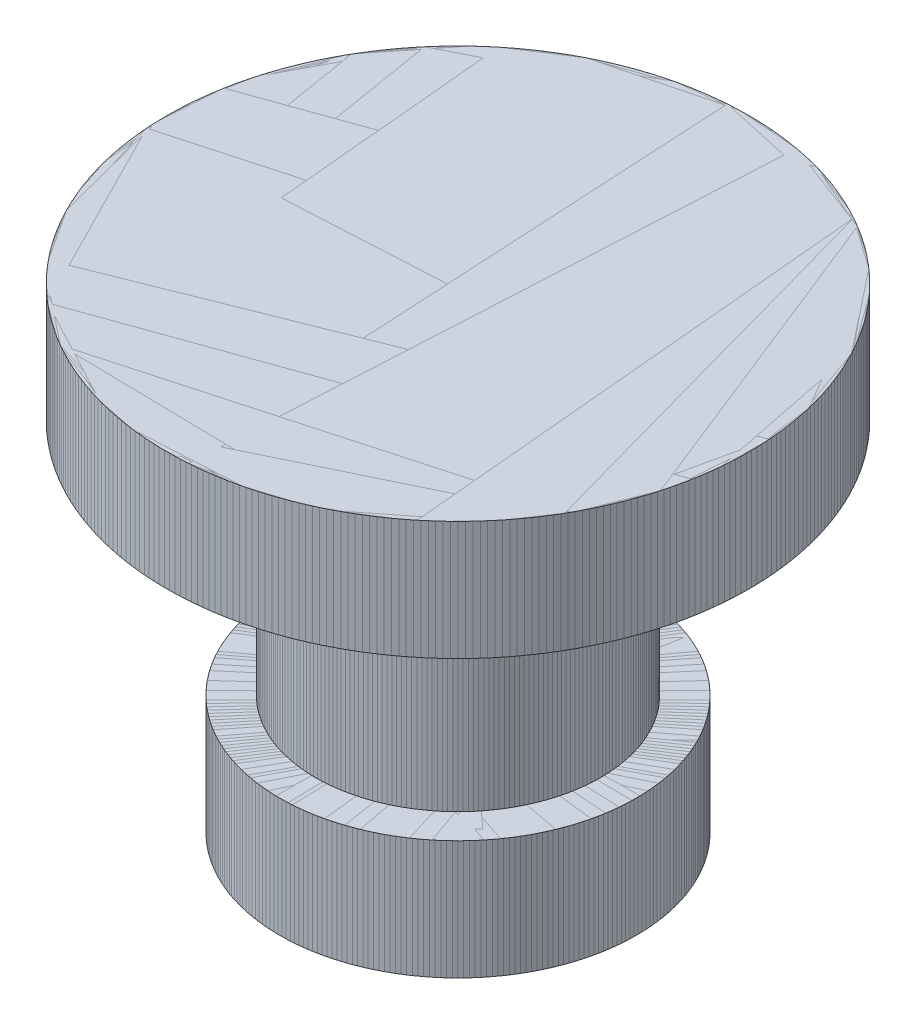
from build123d import *

# Parameters (mm, degrees)
MOAR_SPRINGS_COUNT = 4


with BuildPart() as part:
    # Sketch1 → button body (revolve)
    with BuildSketch(Plane.XY):
        Polygon((0, 0), (6.223, 0), (6.223, -2.54), (3.048, -2.54), (3.048, -7.62), (3.81, -7.62), (3.81, -10.16), (0, -10.16), align=None)
    revolve(axis=Axis((0, -10.16, 0), (0, 1, 0)))


with BuildPart() as moar_springs_1:
    # moar springs: pattern copy
    add(part.part.rotate(Axis((0, 0, 0), (0, -1, 0)), 1 * 360 / MOAR_SPRINGS_COUNT))


with BuildPart() as moar_springs_2:
    # moar springs: pattern copy
    add(part.part.rotate(Axis((0, 0, 0), (0, -1, 0)), 2 * 360 / MOAR_SPRINGS_COUNT))


with BuildPart() as moar_springs_3:
    # moar springs: pattern copy
    add(part.part.rotate(Axis((0, 0, 0), (0, -1, 0)), 3 * 360 / MOAR_SPRINGS_COUNT))


solid = Compound([part.part, moar_springs_1.part, moar_springs_2.part, moar_springs_3.part])
